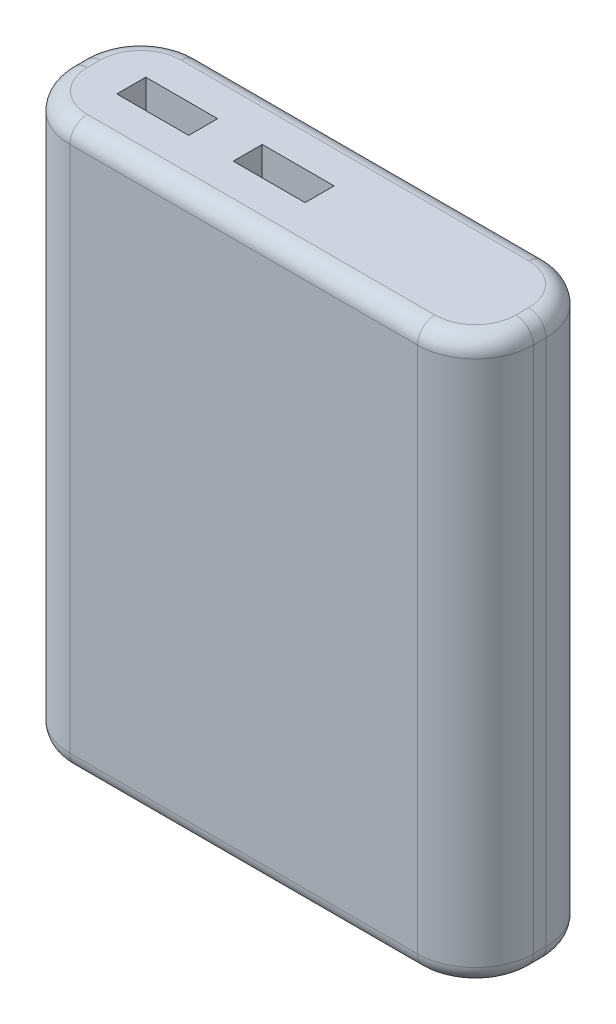
from build123d import *

# Parameters (mm, degrees)
BOSS_EXTRUDE1_DEPTH = 97
FILLET1_R           = 3
SKETCH2_W           = 12.4
SKETCH2_H           = 5
CUT_EXTRUDE1_DEPTH  = 10


with BuildPart() as part:
    # Sketch1 → Boss-Extrude1 (new body)
    with BuildSketch(Plane(origin=(0, 0, 0), x_dir=(1, 0, 0), z_dir=(0, 1, 0))):
        with BuildLine():
            Line((-30, 11.1), (30, 11.1))
            ThreePointArc((30, 11.1), (37.071067812, 8.171067812), (40, 1.1))
            Line((40, 1.1), (40, -1.1))
            ThreePointArc((40, -1.1), (37.071067812, -8.171067812), (30, -11.1))
            Line((30, -11.1), (-30, -11.1))
            ThreePointArc((-30, -11.1), (-37.071067812, -8.171067812), (-40, -1.1))
            Line((-40, -1.1), (-40, 1.1))
            ThreePointArc((-40, 1.1), (-37.071067812, 8.171067812), (-30, 11.1))
        make_face()
    extrude(amount=BOSS_EXTRUDE1_DEPTH)

    # Fillet1
    fillet1_edges = [part.edges().sort_by_distance(p)[0] for p in [
        (37.071067812, 97, -8.171067812),
        (40, 0, 0),
        (37.071067812, 0, 8.171067812),
        (0, 97, -11.1),
        (-37.071067812, 97, -8.171067812),
        (-40, 97, 0),
        (-37.071067812, 97, 8.171067812),
        (0, 97, 11.1),
        (37.071067812, 97, 8.171067812),
        (40, 97, 0),
        (0, 0, 11.1),
        (-37.071067812, 0, 8.171067812),
        (-40, 0, 0),
        (-37.071067812, 0, -8.171067812),
        (0, 0, -11.1),
        (37.071067812, 0, -8.171067812),
    ]]
    fillet(fillet1_edges, radius=FILLET1_R)

    # Sketch2 → Cut-Extrude1 (cut)
    with BuildSketch(Plane(origin=(0, 97, 0), x_dir=(1, 0, 0), z_dir=(0, 1, 0))):
        with Locations((-24.3, 0)):
            Rectangle(SKETCH2_W, SKETCH2_H)
        with Locations((-4.2, 0)):
            Rectangle(SKETCH2_W, SKETCH2_H)
    extrude(amount=-CUT_EXTRUDE1_DEPTH, mode=Mode.SUBTRACT)


solid = part.part
